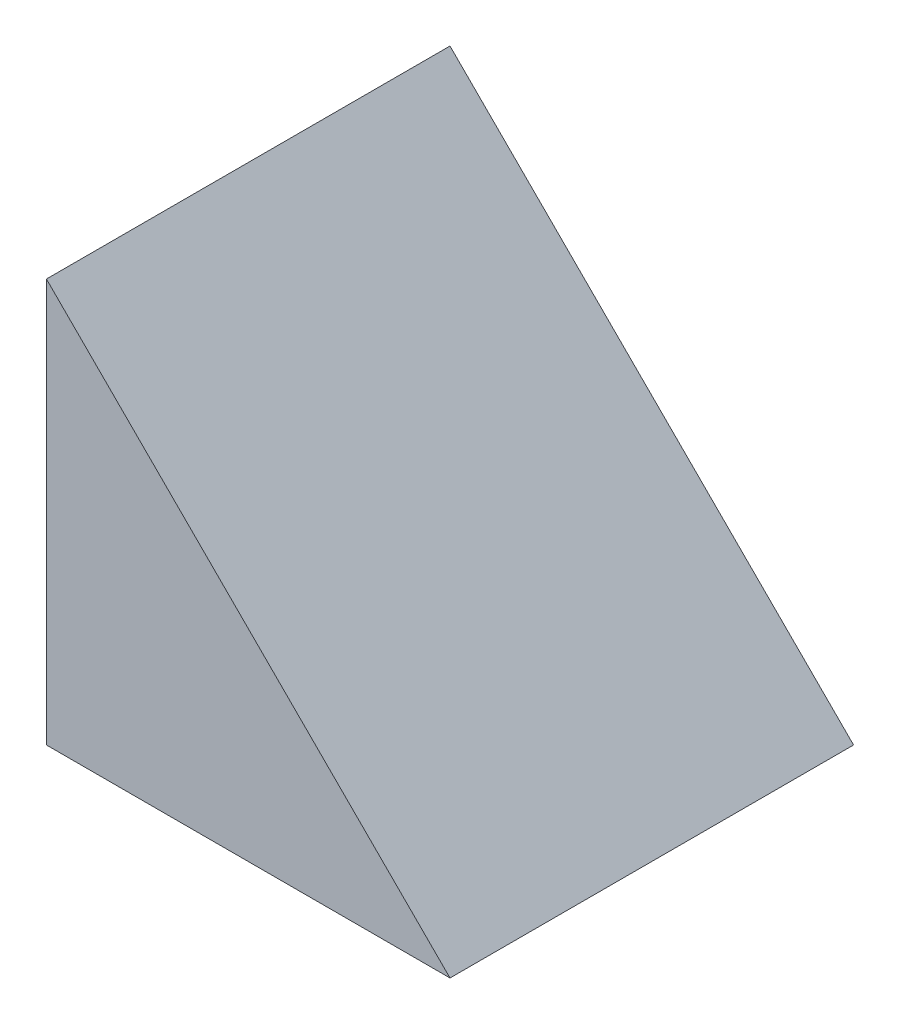
from build123d import *

# Parameters (mm, degrees)
EXTRUDE_1_DEPTH = 20


with BuildPart() as part:
    # 草圖1 → 填料-伸長1 (new body)
    with BuildSketch(Plane.XY):
        Polygon((0, 0), (0, 20), (20, 0), align=None)
    extrude(amount=EXTRUDE_1_DEPTH)


solid = part.part
